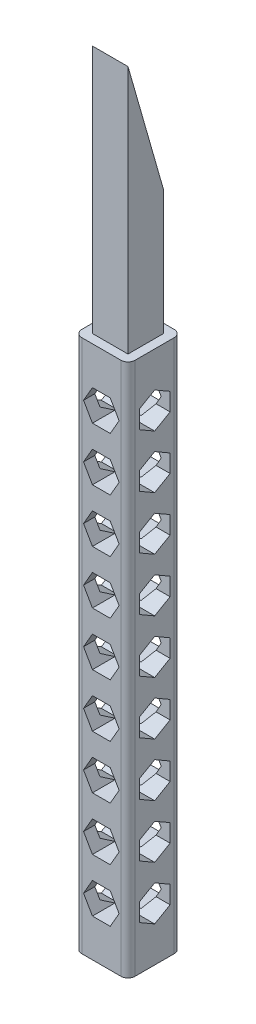
from build123d import *

# Parameters (mm, degrees)
SKETCH1_W           = 15
SKETCH1_H           = 15
BOSS_EXTRUDE1_DEPTH = 150
SKETCH3_W           = 10
SKETCH3_H           = 10
BOSS_EXTRUDE2_DEPTH = 70
CUT_EXTRUDE1_DEPTH  = 70
CUT_EXTRUDE2_DEPTH  = 70
CUT_EXTRUDE3_DEPTH  = 70
FILLET1_R           = 2


with BuildPart() as part:
    # Sketch1 → Boss-Extrude1 (new body)
    with BuildSketch(Plane(origin=(0, 0, 0), x_dir=(1, 0, 0), z_dir=(0, 1, 0))):
        Rectangle(SKETCH1_W, SKETCH1_H)
    extrude(amount=BOSS_EXTRUDE1_DEPTH)

    # Sketch3 → Boss-Extrude2 (add)
    with BuildSketch(Plane(origin=(0, 150, 0), x_dir=(1, 0, 0), z_dir=(0, 1, 0))):
        Rectangle(SKETCH3_W, SKETCH3_H)
    extrude(amount=BOSS_EXTRUDE2_DEPTH)

    # Sketch4 → Cut-Extrude1 (cut)
    with BuildSketch(Plane.ZY.offset(5)):
        Polygon((-5, 185), (5, 220), (-5, 220), align=None)
    extrude(amount=-CUT_EXTRUDE1_DEPTH, mode=Mode.SUBTRACT)

    # Sketch5 → Cut-Extrude2 (cut)
    with BuildSketch(Plane(origin=(0, 0, -7.5), x_dir=(-1, 0, 0), z_dir=(0, 0, -1))):
        Polygon((5, 90), (2.5, 94.330127019), (-2.5, 94.330127019), (-5, 90), (-2.5, 85.669872981), (2.5, 85.669872981), align=None)
        Polygon((5, 75), (2.5, 79.330127019), (-2.5, 79.330127019), (-5, 75), (-2.5, 70.669872981), (2.5, 70.669872981), align=None)
        Polygon((5, 105), (2.5, 109.330127019), (-2.5, 109.330127019), (-5, 105), (-2.5, 100.669872981), (2.5, 100.669872981), align=None)
        Polygon((5, 120), (2.5, 124.330127019), (-2.5, 124.330127019), (-5, 120), (-2.5, 115.669872981), (2.5, 115.669872981), align=None)
        Polygon((5, 135), (2.5, 139.330127019), (-2.5, 139.330127019), (-5, 135), (-2.5, 130.669872981), (2.5, 130.669872981), align=None)
        Polygon((5, 60), (2.5, 64.330127019), (-2.5, 64.330127019), (-5, 60), (-2.5, 55.669872981), (2.5, 55.669872981), align=None)
        Polygon((5, 45), (2.5, 49.330127019), (-2.5, 49.330127019), (-5, 45), (-2.5, 40.669872981), (2.5, 40.669872981), align=None)
        Polygon((5, 30), (2.5, 34.330127019), (-2.5, 34.330127019), (-5, 30), (-2.5, 25.669872981), (2.5, 25.669872981), align=None)
        Polygon((5, 15), (2.5, 19.330127019), (-2.5, 19.330127019), (-5, 15), (-2.5, 10.669872981), (2.5, 10.669872981), align=None)
    extrude(amount=-CUT_EXTRUDE2_DEPTH, mode=Mode.SUBTRACT)

    # Sketch6 → Cut-Extrude3 (cut)
    with BuildSketch(Plane.ZY.offset(7.5)):
        Polygon((0, 85), (4.330127019, 87.5), (4.330127019, 92.5), (0, 95), (-4.330127019, 92.5), (-4.330127019, 87.5), align=None)
        Polygon((0, 70), (4.330127019, 72.5), (4.330127019, 77.5), (0, 80), (-4.330127019, 77.5), (-4.330127019, 72.5), align=None)
        Polygon((0, 100), (4.330127019, 102.5), (4.330127019, 107.5), (0, 110), (-4.330127019, 107.5), (-4.330127019, 102.5), align=None)
        Polygon((0, 115), (4.330127019, 117.5), (4.330127019, 122.5), (0, 125), (-4.330127019, 122.5), (-4.330127019, 117.5), align=None)
        Polygon((0, 130), (4.330127019, 132.5), (4.330127019, 137.5), (0, 140), (-4.330127019, 137.5), (-4.330127019, 132.5), align=None)
        Polygon((0, 55), (4.330127019, 57.5), (4.330127019, 62.5), (0, 65), (-4.330127019, 62.5), (-4.330127019, 57.5), align=None)
        Polygon((0, 40), (4.330127019, 42.5), (4.330127019, 47.5), (0, 50), (-4.330127019, 47.5), (-4.330127019, 42.5), align=None)
        Polygon((0, 25), (4.330127019, 27.5), (4.330127019, 32.5), (0, 35), (-4.330127019, 32.5), (-4.330127019, 27.5), align=None)
        Polygon((0, 10), (4.330127019, 12.5), (4.330127019, 17.5), (0, 20), (-4.330127019, 17.5), (-4.330127019, 12.5), align=None)
    extrude(amount=-CUT_EXTRUDE3_DEPTH, mode=Mode.SUBTRACT)

    # Fillet1
    fillet1_edges = [part.edges().sort_by_distance(p)[0] for p in [
        (7.5, 75, 7.5),
        (-7.5, 75, 7.5),
        (-7.5, 75, -7.5),
        (7.5, 75, -7.5),
    ]]
    fillet(fillet1_edges, radius=FILLET1_R)


solid = part.part
